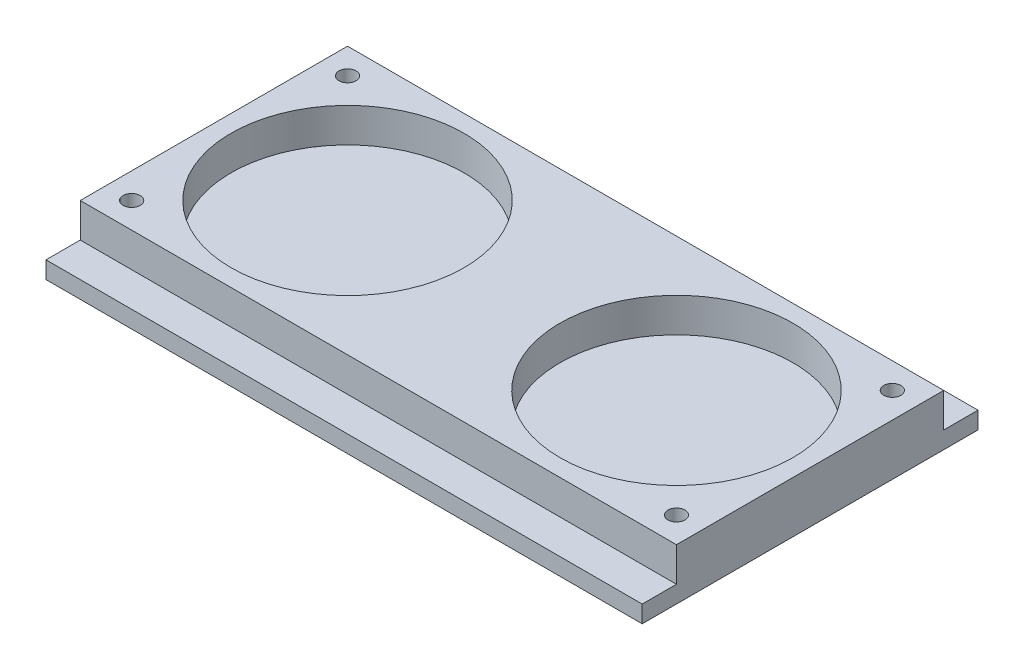
from build123d import *

# Parameters (mm, degrees)
SKETCH1_W           = 174
SKETCH1_H           = 78
SKETCH1_R           = 2.5
SKETCH1_R_2         = 34
BOSS_EXTRUDE1_DEPTH = 10
BOSS_EXTRUDE2_START = -5
SKETCH1_3_W         = 174
SKETCH1_3_H         = 98
SKETCH1_3_R         = 2.5
BOSS_EXTRUDE2_DEPTH = 5


with BuildPart() as part:
    # Sketch1 → Boss-Extrude1 (new body)
    with BuildSketch(Plane(origin=(0, 0, 0), x_dir=(1, 0, 0), z_dir=(0, 1, 0))):
        Rectangle(SKETCH1_W, SKETCH1_H)
        with Locations((-79.5, -31.5)):
            Circle(SKETCH1_R, mode=Mode.SUBTRACT)
        with Locations((-48, 0)):
            Circle(SKETCH1_R_2, mode=Mode.SUBTRACT)
        with Locations((79.5, -31.5)):
            Circle(SKETCH1_R, mode=Mode.SUBTRACT)
        with Locations((48, 0)):
            Circle(SKETCH1_R_2, mode=Mode.SUBTRACT)
        with Locations((-79.5, 31.5)):
            Circle(SKETCH1_R, mode=Mode.SUBTRACT)
        with Locations((79.5, 31.5)):
            Circle(SKETCH1_R, mode=Mode.SUBTRACT)
    extrude(amount=BOSS_EXTRUDE1_DEPTH)

    # Sketch1<3> → Boss-Extrude2 (add)
    with BuildSketch(Plane(origin=(0, 0, 0), x_dir=(1, 0, 0), z_dir=(0, 1, 0)).offset(BOSS_EXTRUDE2_START)):
        Rectangle(SKETCH1_3_W, SKETCH1_3_H)
        with Locations((79.5, 31.5)):
            Circle(SKETCH1_3_R, mode=Mode.SUBTRACT)
        with Locations((-79.5, -31.5)):
            Circle(SKETCH1_3_R, mode=Mode.SUBTRACT)
        with Locations((79.5, -31.5)):
            Circle(SKETCH1_3_R, mode=Mode.SUBTRACT)
        with Locations((-79.5, 31.5)):
            Circle(SKETCH1_3_R, mode=Mode.SUBTRACT)
    extrude(amount=BOSS_EXTRUDE2_DEPTH)


solid = part.part
